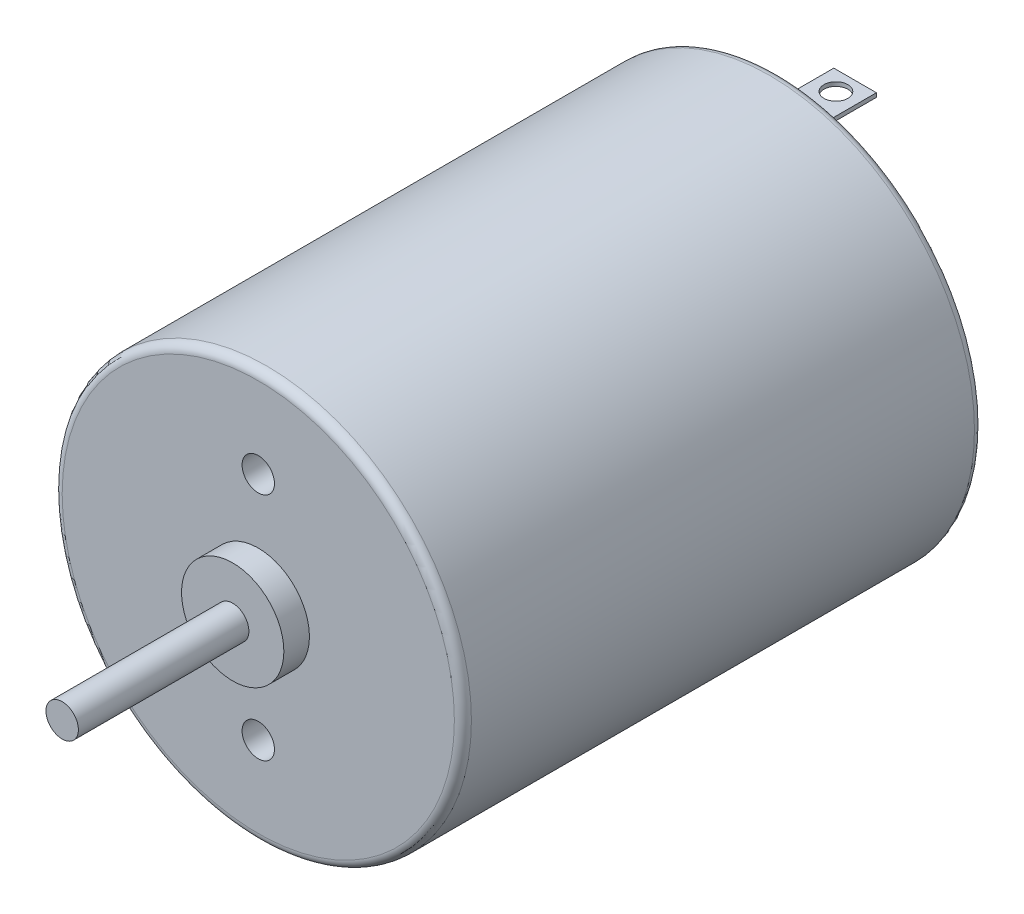
from build123d import *

# Parameters (mm, degrees)
ESQUISSE1_R             = 12
BOSS_EXTRU_1_DEPTH      = 30.5
ESQUISSE2_R             = 4.5
BOSS_EXTRU_2_DEPTH      = 2
ESQUISSE3_R             = 3
BOSS_EXTRU_3_DEPTH      = 1.5
BOSS_EXTRU_4_DEPTH      = 4.5
ENL_V_MAT_EXTRU_1_DEPTH = 29.5
ESQUISSE6_R             = 0.95
BOSS_EXTRU_5_DEPTH      = 10
ESQUISSE7_R             = 0.95
ENL_V_MAT_EXTRU_2_DEPTH = 0.2
CONG_1_R                = 0.5
CONG_2_R                = 0.5
ENL_V_MAT_EXTRU_3_DEPTH = 20


with BuildPart() as part:
    # Esquisse1 → Boss.-Extru.1 (new body)
    with BuildSketch(Plane.XY):
        with Locations(Location((0, 0, 0), (0, 0, 180))):
            Circle(ESQUISSE1_R)
    extrude(amount=BOSS_EXTRU_1_DEPTH)

    # Esquisse2 → Boss.-Extru.2 (add)
    with BuildSketch(Plane(origin=(0, 0, 0), x_dir=(-1, 0, 0), z_dir=(0, 0, -1))):
        Circle(ESQUISSE2_R)
    extrude(amount=BOSS_EXTRU_2_DEPTH)

    # Esquisse3 → Boss.-Extru.3 (add)
    with BuildSketch(Plane.XY.offset(30.5)):
        Circle(ESQUISSE3_R)
    extrude(amount=BOSS_EXTRU_3_DEPTH)

    # Esquisse4 → Boss.-Extru.4 (add)
    with BuildSketch(Plane(origin=(0, 0, 0), x_dir=(-1, 0, 0), z_dir=(0, 0, -1))):
        with BuildLine():
            Line((0, -9.25), (0, -9.012847415))
            Line((0, -9.012847415), (-1.25, -9.012847415))
            Line((-1.25, -9.012847415), (-1.25, -9.16515139))
            ThreePointArc((-1.25, -9.16515139), (-0.626438203, -9.22876347), (0, -9.25))
        make_face()
        with BuildLine():
            Line((-1.25, -9.25), (0, -9.25))
            ThreePointArc((0, -9.25), (-0.626438203, -9.22876347), (-1.25, -9.16515139))
            Line((-1.25, -9.16515139), (-1.25, -9.25))
        make_face()
        with BuildLine():
            Line((1.25, -9.012847415), (0, -9.012847415))
            Line((0, -9.012847415), (0, -9.25))
            ThreePointArc((0, -9.25), (0.626438203, -9.22876347), (1.25, -9.16515139))
            Line((1.25, -9.16515139), (1.25, -9.012847415))
        make_face()
        with BuildLine():
            ThreePointArc((1.25, -9.16515139), (0.626438203, -9.22876347), (0, -9.25))
            Line((0, -9.25), (1.25, -9.25))
            Line((1.25, -9.25), (1.25, -9.16515139))
        make_face()
        with BuildLine():
            Line((0, 9.25), (0, 9.012847415))
            Line((0, 9.012847415), (1.25, 9.012847415))
            Line((1.25, 9.012847415), (1.25, 9.16515139))
            ThreePointArc((1.25, 9.16515139), (0.626438203, 9.22876347), (0, 9.25))
        make_face()
        with BuildLine():
            ThreePointArc((0, 9.25), (0.626438203, 9.22876347), (1.25, 9.16515139))
            Line((1.25, 9.16515139), (1.25, 9.25))
            Line((1.25, 9.25), (0, 9.25))
        make_face()
        with BuildLine():
            Line((-1.25, 9.012847415), (0, 9.012847415))
            Line((0, 9.012847415), (0, 9.25))
            ThreePointArc((0, 9.25), (-0.626438203, 9.22876347), (-1.25, 9.16515139))
            Line((-1.25, 9.16515139), (-1.25, 9.012847415))
        make_face()
        with BuildLine():
            Line((-1.25, 9.25), (-1.25, 9.16515139))
            ThreePointArc((-1.25, 9.16515139), (-0.626438203, 9.22876347), (0, 9.25))
            Line((0, 9.25), (-1.25, 9.25))
        make_face()
    extrude(amount=BOSS_EXTRU_4_DEPTH)

    # Esquisse5 → Enlèv. mat.-Extru.1 (cut)
    with BuildSketch(Plane(origin=(0, 9.25, 0), x_dir=(1, 0, 0), z_dir=(0, 1, 0))):
        with BuildLine():
            ThreePointArc((0.7, 3.375), (0.494974747, 3.869974747), (0, 4.075))
            Line((0, 4.075), (0, 2.675))
            ThreePointArc((0, 2.675), (0.494974747, 2.880025253), (0.7, 3.375))
        make_face()
        with BuildLine():
            Line((0, 2.675), (0, 4.075))
            ThreePointArc((0, 4.075), (-0.7, 3.375), (0, 2.675))
        make_face()
    extrude(amount=-ENL_V_MAT_EXTRU_1_DEPTH, mode=Mode.SUBTRACT)

    # Esquisse6 → Boss.-Extru.5 (add)
    with BuildSketch(Plane.XY.offset(32)):
        Circle(ESQUISSE6_R)
    extrude(amount=BOSS_EXTRU_5_DEPTH)

    # Esquisse7 → Enlèv. mat.-Extru.2 (cut)
    with BuildSketch(Plane(origin=(0, 0, -2), x_dir=(-1, 0, 0), z_dir=(0, 0, -1))):
        with Locations(Location((0, 0, 0), (0, 0, 180))):
            Circle(ESQUISSE7_R)
    extrude(amount=-ENL_V_MAT_EXTRU_2_DEPTH, mode=Mode.SUBTRACT)

    # Congé1
    cong_1_edges = [part.edges().sort_by_distance(p)[0] for p in [
        (12, 0, 30.5),
    ]]
    fillet(cong_1_edges, radius=CONG_1_R)

    # Congé2
    cong_2_edges = [part.edges().sort_by_distance(p)[0] for p in [
        (-1.25, -9.131423708, 0),
        (1.25, -9.131423708, 0),
        (0, -9.012847415, 0),
        (0, -9.25, 0),
        (12, 0, 0),
        (1.25, 9.131423708, 0),
        (0, 9.012847415, 0),
        (-1.25, 9.131423708, 0),
        (0, 9.25, 0),
        (4.5, 0, 0),
    ]]
    fillet(cong_2_edges, radius=CONG_2_R)

    # Esquisse8 → Enlèv. mat.-Extru.3 (cut)
    with BuildSketch(Plane.XY.offset(30.5)):
        with BuildLine():
            ThreePointArc((-0.947644886, 6.683148148), (-0.647684623, 6.055014655), (0, 5.8))
            Line((0, 5.8), (0, 6.75))
            ThreePointArc((0, 6.75), (-0.475, 6.733266295), (-0.947644886, 6.683148148))
        make_face()
        with BuildLine():
            Line((0, 6.75), (0, 5.8))
            ThreePointArc((0, 5.8), (0.647684623, 6.055014655), (0.947644886, 6.683148148))
            ThreePointArc((0.947644886, 6.683148148), (0.475, 6.733266295), (0, 6.75))
        make_face()
        with BuildLine():
            ThreePointArc((-0.947644886, 6.683148148), (-0.475, 6.733266295), (0, 6.75))
            Line((0, 6.75), (0, 7.7))
            ThreePointArc((0, 7.7), (-0.694985345, 7.397684623), (-0.947644886, 6.683148148))
        make_face()
        with BuildLine():
            Line((0, 7.7), (0, 6.75))
            ThreePointArc((0, 6.75), (0.475, 6.733266295), (0.947644886, 6.683148148))
            ThreePointArc((0.947644886, 6.683148148), (0.949411039, 6.716553339), (0.95, 6.75))
            ThreePointArc((0.95, 6.75), (0.671751442, 7.421751442), (0, 7.7))
        make_face()
        with BuildLine():
            ThreePointArc((0.947644886, -6.683148148), (0.647684623, -6.055014655), (0, -5.8))
            Line((0, -5.8), (0, -6.75))
            ThreePointArc((0, -6.75), (0.475, -6.733266295), (0.947644886, -6.683148148))
        make_face()
        with BuildLine():
            Line((0, -6.75), (0, -5.8))
            ThreePointArc((0, -5.8), (-0.647684623, -6.055014655), (-0.947644886, -6.683148148))
            ThreePointArc((-0.947644886, -6.683148148), (-0.475, -6.733266295), (0, -6.75))
        make_face()
        with BuildLine():
            ThreePointArc((0.947644886, -6.683148148), (0.475, -6.733266295), (0, -6.75))
            Line((0, -6.75), (0, -7.7))
            ThreePointArc((0, -7.7), (0.671751442, -7.421751442), (0.95, -6.75))
            ThreePointArc((0.95, -6.75), (0.949411039, -6.716553339), (0.947644886, -6.683148148))
        make_face()
        with BuildLine():
            Line((0, -7.7), (0, -6.75))
            ThreePointArc((0, -6.75), (-0.475, -6.733266295), (-0.947644886, -6.683148148))
            ThreePointArc((-0.947644886, -6.683148148), (-0.694985345, -7.397684623), (0, -7.7))
        make_face()
    extrude(amount=-ENL_V_MAT_EXTRU_3_DEPTH, mode=Mode.SUBTRACT)


solid = part.part
